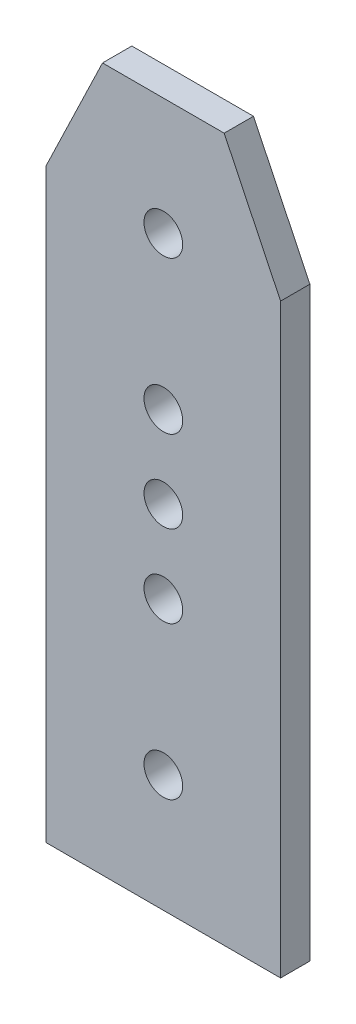
from build123d import *

# Parameters (mm, degrees)
BOSS_EXTRUDE1_DEPTH     = 1.5875
CUT_EXTRUDE1_DEPTH      = 41.286233691
CUT_EXTRUDE1_DEPTH_BACK = 41.286233691
SKETCH2_R               = 2.0955


with BuildPart() as part:
    # Sketch1 → Boss-Extrude1 (new, symmetric)
    with BuildSketch(Plane.XY):
        Polygon((12.7, 25.4), (6.588707745, 38.1), (-6.588707745, 38.1), (-12.7, 25.4), (-12.7, -38.1), (12.7, -38.1), align=None)
    extrude(amount=BOSS_EXTRUDE1_DEPTH, both=True)

    # Sketch2 → Cut-Extrude1 (cut, two sides: drawn at the far end of the back side and taken through both)
    with BuildSketch(Plane.XY.offset(1.5875).offset(-CUT_EXTRUDE1_DEPTH_BACK)):
        with Locations((0, -25.4)):
            Circle(SKETCH2_R)
        Circle(SKETCH2_R)
        with Locations((0, 25.4)):
            Circle(SKETCH2_R)
        with Locations((0, -8.89)):
            Circle(SKETCH2_R)
        with Locations((0, 8.89)):
            Circle(SKETCH2_R)
    extrude(amount=CUT_EXTRUDE1_DEPTH + CUT_EXTRUDE1_DEPTH_BACK, mode=Mode.SUBTRACT)


solid = part.part
